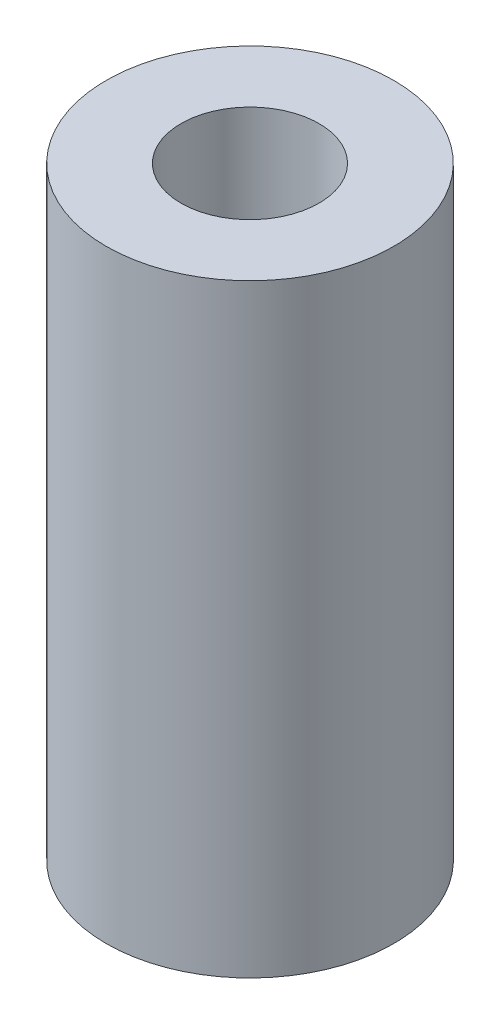
from build123d import *

# Parameters (mm, degrees)
SKETCH1_R            = 2.5
BOSS_EXTRUDE1_DEPTH  = 5.25
M2_CLEARANCE_HOLE1_D = 2.4


with BuildPart() as part:
    # Sketch1 → Boss-Extrude1 (new, symmetric)
    with BuildSketch(Plane(origin=(0, 0, 0), x_dir=(1, 0, 0), z_dir=(0, 1, 0))):
        with Locations(Location((0, 0, 0), (0, 0, 90))):
            Circle(SKETCH1_R)
    extrude(amount=BOSS_EXTRUDE1_DEPTH, both=True)

    # M2 Clearance Hole1 (through all)
    with Locations(Plane(origin=(0, 5.25, 0), x_dir=(1, 0, 0), z_dir=(0, 1, 0))):
        with Locations((0, 0)):
            Hole(M2_CLEARANCE_HOLE1_D / 2)


solid = part.part
